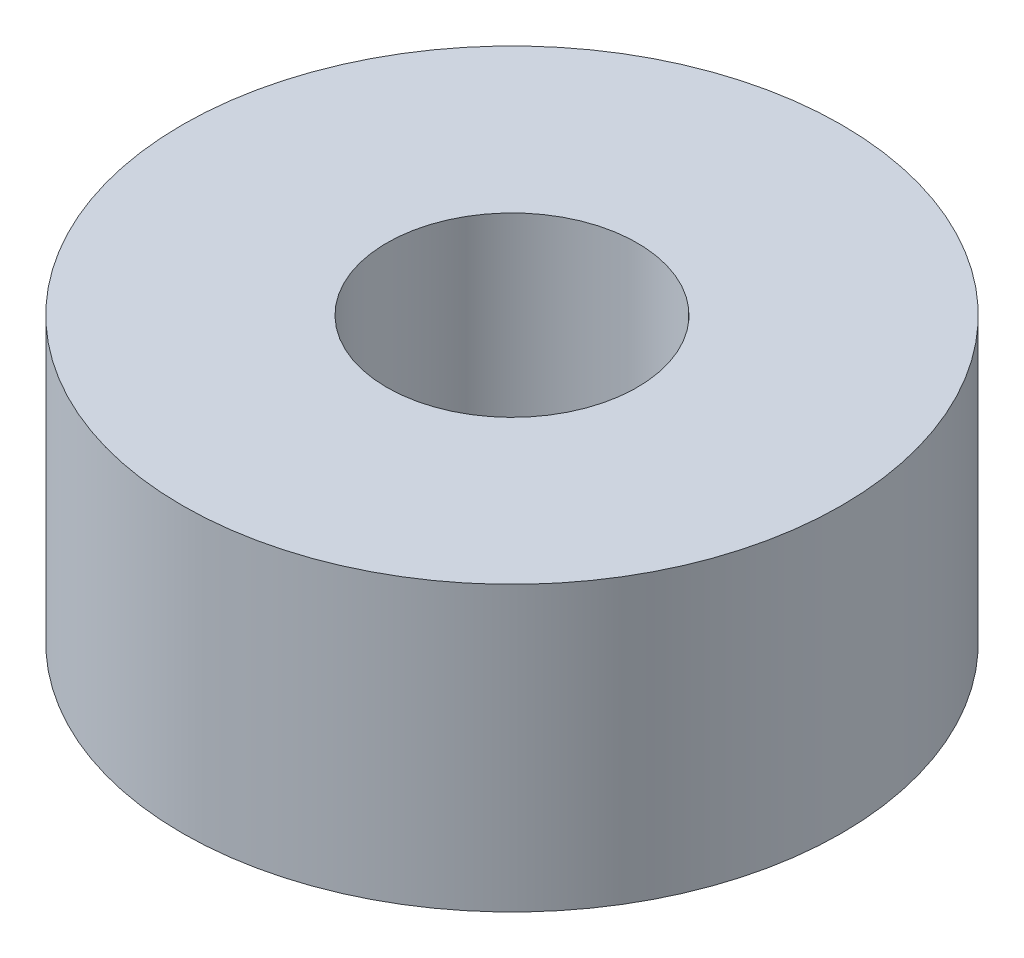
from build123d import *

# Parameters (mm, degrees)
SKETCH_1_R      = 3.95
SKETCH_1_R_2    = 1.5
EXTRUDE_1_DEPTH = 3.4


with BuildPart() as part:
    # 草图1 → 凸台-拉伸1 (new body)
    with BuildSketch(Plane(origin=(0, 0, 0), x_dir=(1, 0, 0), z_dir=(0, 1, 0))):
        with Locations(Location((0, 0, 0), (0, 0, 270))):
            Circle(SKETCH_1_R)
        with Locations(Location((0, 0, 0), (0, 0, 270))):
            Circle(SKETCH_1_R_2, mode=Mode.SUBTRACT)
    extrude(amount=EXTRUDE_1_DEPTH)


solid = part.part
